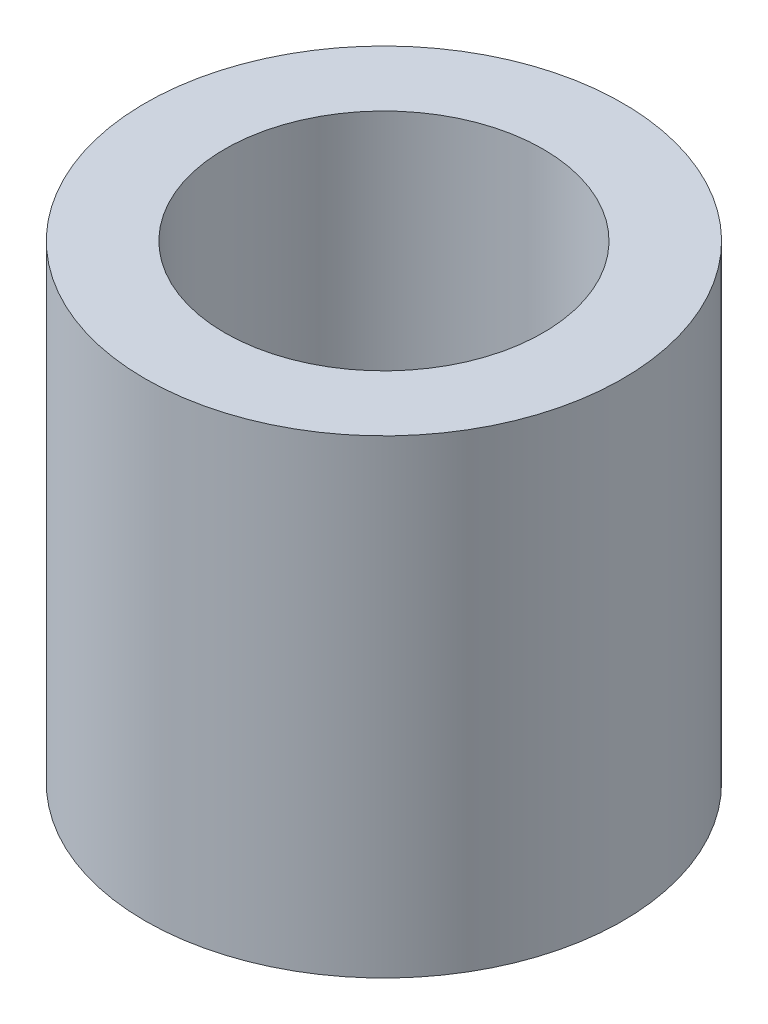
from build123d import *

# Parameters (mm, degrees)
SKETCH1_R           = 7.5
BOSS_EXTRUDE1_DEPTH = 14.75
SKETCH2_R           = 5
CUT_EXTRUDE1_DEPTH  = 10


with BuildPart() as part:
    # Sketch1 → Boss-Extrude1 (new body)
    with BuildSketch(Plane(origin=(0, 0, 0), x_dir=(1, 0, 0), z_dir=(0, 1, 0))):
        with Locations(Location((0, 0, 0), (0, 0, 270))):
            Circle(SKETCH1_R)
    extrude(amount=BOSS_EXTRUDE1_DEPTH)

    # Sketch2 → Cut-Extrude1 (cut)
    with BuildSketch(Plane(origin=(0, 14.75, 0), x_dir=(1, 0, 0), z_dir=(0, 1, 0))):
        with Locations(Location((0, 0, 0), (0, 0, 270))):
            Circle(SKETCH2_R)
    extrude(amount=-CUT_EXTRUDE1_DEPTH, mode=Mode.SUBTRACT)


solid = part.part
